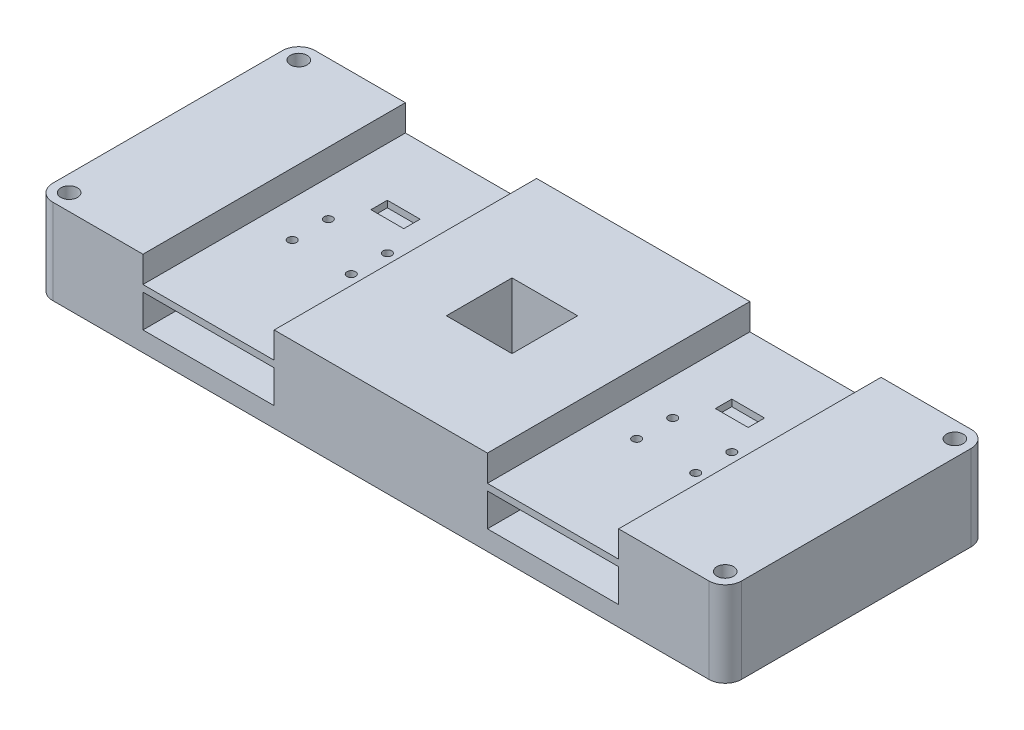
from build123d import *

# Parameters (mm, degrees)
BOSS_EXTRUDE1_DEPTH     = 26
SKETCH2_W               = 40
SKETCH2_H               = 20
CUT_EXTRUDE1_DEPTH      = 227.221130755
F_1_4_20_TAPPED_HOLE1_D = 5.1054
SKETCH4_W               = 20
SKETCH4_H               = 20
CUT_EXTRUDE2_DEPTH      = 227.221130755
BOSS_EXTRUDE2_DEPTH     = 80
SKETCH6_R               = 1.3
SKETCH6_W               = 10
SKETCH6_H               = 5
CUT_EXTRUDE3_DEPTH      = 10


with BuildPart() as part:
    # Sketch1 → Boss-Extrude1 (new body)
    with BuildSketch(Plane(origin=(0, 0, 0), x_dir=(1, 0, 0), z_dir=(0, 1, 0))):
        with BuildLine():
            Line((5, 0), (205, 0))
            ThreePointArc((205, 0), (208.535533906, 1.464466094), (210, 5))
            Line((210, 5), (210, 75))
            ThreePointArc((210, 75), (208.535533906, 78.535533906), (205, 80))
            Line((205, 80), (5, 80))
            ThreePointArc((5, 80), (1.464466094, 78.535533906), (0, 75))
            Line((0, 75), (0, 5))
            ThreePointArc((0, 5), (1.464466094, 1.464466094), (5, 0))
        make_face()
    extrude(amount=BOSS_EXTRUDE1_DEPTH)

    # Sketch2 → Cut-Extrude1 (cut, through all)
    with BuildSketch(Plane.XY):
        with Locations((52.5, 16)):
            Rectangle(SKETCH2_W, SKETCH2_H)
        with Locations((157.5, 16)):
            Rectangle(SKETCH2_W, SKETCH2_H)
    extrude(amount=-CUT_EXTRUDE1_DEPTH, mode=Mode.SUBTRACT)

    # 1/4-20 Tapped Hole1 (through all)
    with Locations(Plane(origin=(5, 26, -75), x_dir=(0, 0, 1), z_dir=(0, 1, 0))):
        with Locations((0, 0), (70, 0), (70, 200), (0, 200)):
            Hole(F_1_4_20_TAPPED_HOLE1_D / 2)

    # Sketch4 → Cut-Extrude2 (cut, through all)
    with BuildSketch(Plane(origin=(0, 26, 0), x_dir=(1, 0, 0), z_dir=(0, 1, 0))):
        with Locations((105, 40)):
            Rectangle(SKETCH4_W, SKETCH4_H)
    extrude(amount=-CUT_EXTRUDE2_DEPTH, mode=Mode.SUBTRACT)

    # Sketch5 → Boss-Extrude2 (add)
    with BuildSketch(Plane.XY):
        Polygon((32.5, 18), (27.5, 18), (27.5, 13), (29.5, 13), (29.5, 16), (32.5, 16), (72.5, 16), (75.5, 16), (75.5, 13), (77.5, 13), (77.5, 18), (72.5, 18), align=None)
        Polygon((134.5, 13), (134.5, 16), (137.5, 16), (177.5, 16), (180.5, 16), (180.5, 13), (182.5, 13), (182.5, 18), (177.5, 18), (137.5, 18), (132.5, 18), (132.5, 13), align=None)
    extrude(amount=-BOSS_EXTRUDE2_DEPTH)

    # Sketch6 → Cut-Extrude3 (cut)
    with BuildSketch(Plane(origin=(0, 18, 0), x_dir=(1, 0, 0), z_dir=(0, 1, 0))):
        with Locations(Location((43.5, 45.5, 0), (0, 0, 270))):
            Circle(SKETCH6_R)
        with Locations(Location((43.5, 34.5, 0), (0, 0, 90))):
            Circle(SKETCH6_R)
        with Locations(Location((61.5, 34.5, 0), (0, 0, 270))):
            Circle(SKETCH6_R)
        with Locations(Location((61.5, 45.5, 0), (0, 0, 90))):
            Circle(SKETCH6_R)
        with Locations(Location((148.5, 34.5, 0), (0, 0, 90))):
            Circle(SKETCH6_R)
        with Locations(Location((148.5, 45.5, 0), (0, 0, 270))):
            Circle(SKETCH6_R)
        with Locations(Location((166.5, 45.5, 0), (0, 0, 90))):
            Circle(SKETCH6_R)
        with Locations(Location((166.5, 34.5, 0), (0, 0, 270))):
            Circle(SKETCH6_R)
        with Locations((157.5, 57)):
            Rectangle(SKETCH6_W, SKETCH6_H)
        with Locations((52.5, 57)):
            Rectangle(SKETCH6_W, SKETCH6_H)
    extrude(amount=-CUT_EXTRUDE3_DEPTH, mode=Mode.SUBTRACT)


solid = part.part
